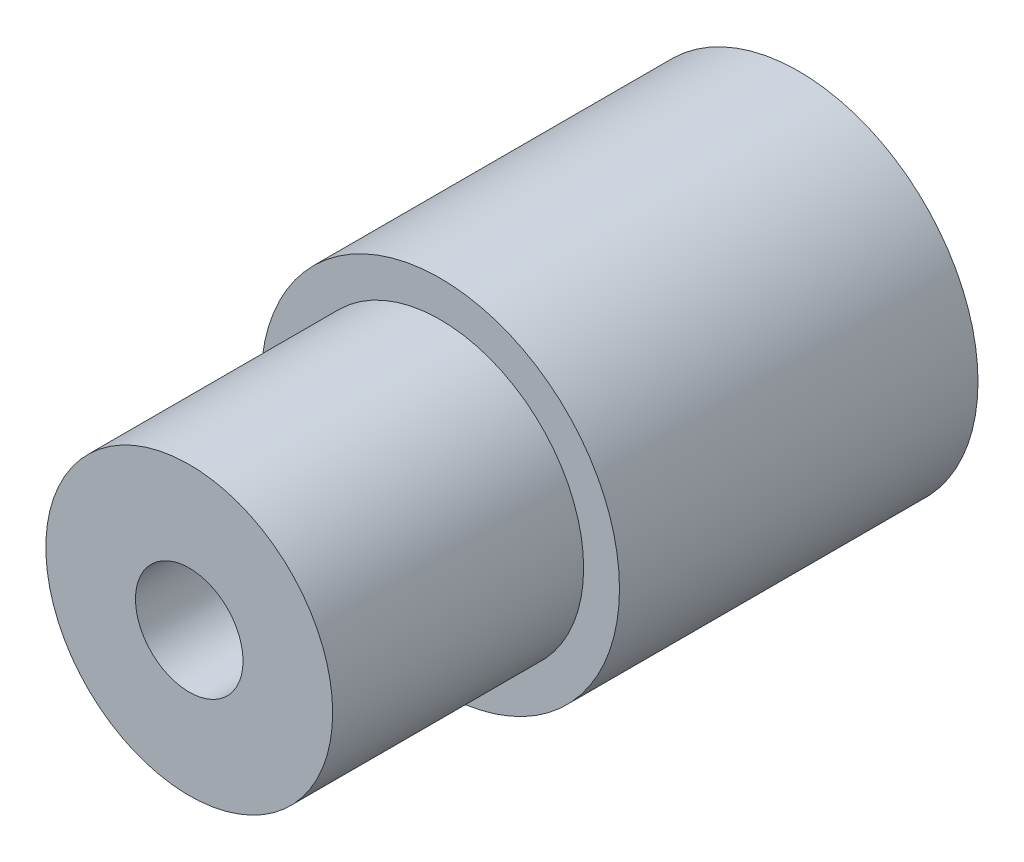
from build123d import *

# Parameters (mm, degrees)
SKETCH1_R           = 5
SKETCH1_R_2         = 1.5
BOSS_EXTRUDE1_DEPTH = 10
SKETCH2_R           = 4
SKETCH2_R_2         = 1.5
BOSS_EXTRUDE2_DEPTH = 7


with BuildPart() as part:
    # Sketch1 → Boss-Extrude1 (new body)
    with BuildSketch(Plane.XY):
        Circle(SKETCH1_R)
        Circle(SKETCH1_R_2, mode=Mode.SUBTRACT)
    extrude(amount=BOSS_EXTRUDE1_DEPTH)

    # Sketch2 → Boss-Extrude2 (add)
    with BuildSketch(Plane.XY.offset(10)):
        Circle(SKETCH2_R)
        Circle(SKETCH2_R_2, mode=Mode.SUBTRACT)
    extrude(amount=BOSS_EXTRUDE2_DEPTH)


solid = part.part
